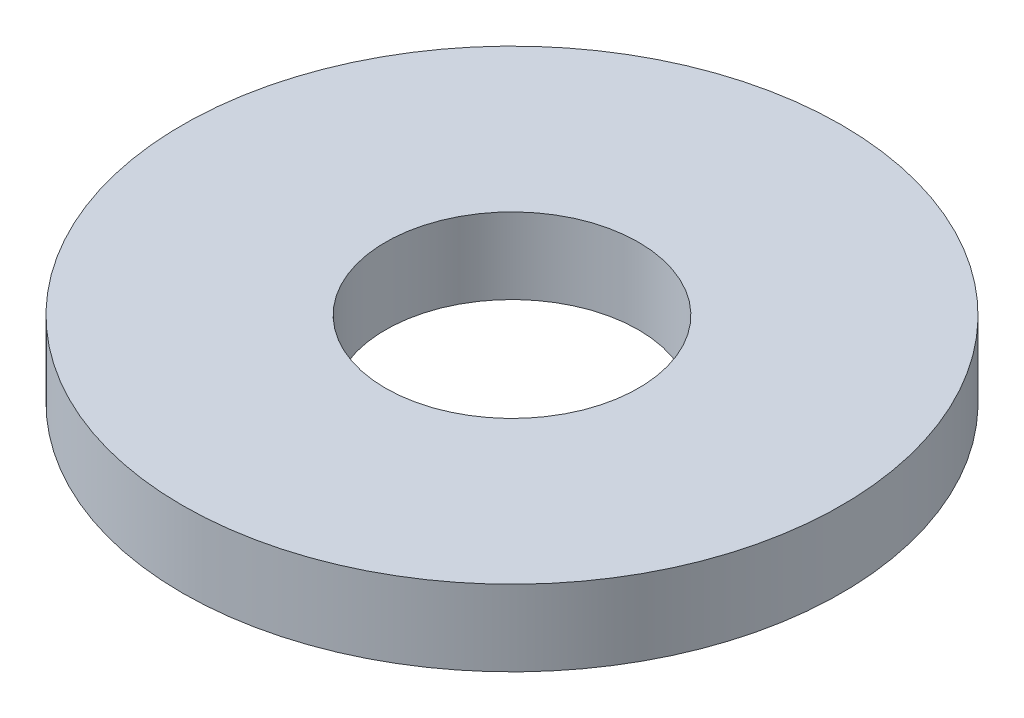
from build123d import *

# Parameters (mm, degrees)
SKETCH1_R           = 6.2865
SKETCH1_R_2         = 2.413
BOSS_EXTRUDE1_DEPTH = 1.4478


with BuildPart() as part:
    # Sketch1 → Boss-Extrude1 (new body)
    with BuildSketch(Plane(origin=(0, 0, 0), x_dir=(1, 0, 0), z_dir=(0, 1, 0))):
        with Locations(Location((0, 0, 0), (0, 0, 270))):
            Circle(SKETCH1_R)
        with Locations(Location((0, 0, 0), (0, 0, 270))):
            Circle(SKETCH1_R_2, mode=Mode.SUBTRACT)
    extrude(amount=BOSS_EXTRUDE1_DEPTH)


solid = part.part
